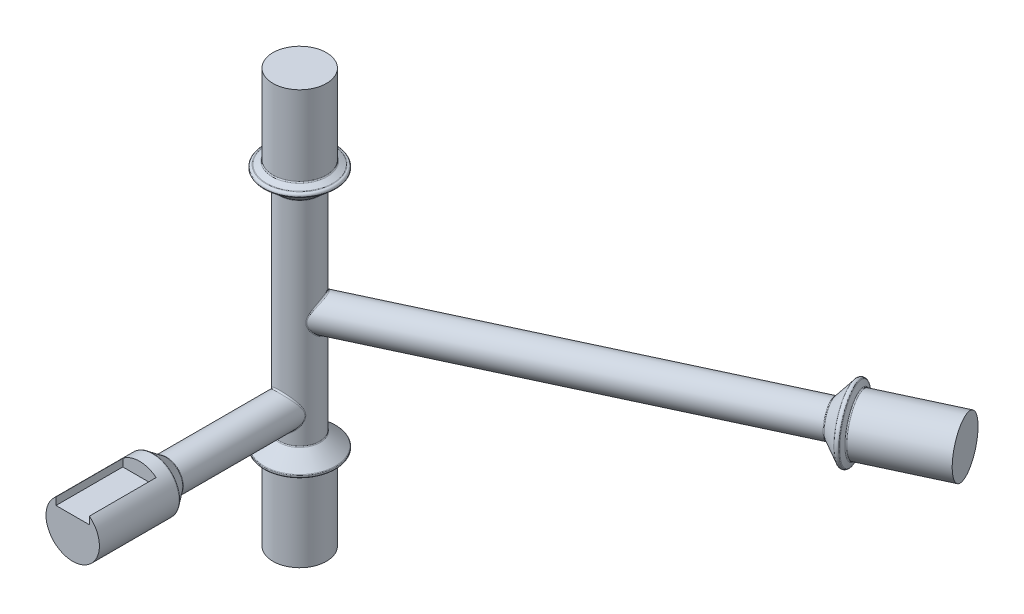
from build123d import *

# Parameters (mm, degrees)
SKETCH5_R           = 2.5
BOSS_EXTRUDE3_DEPTH = 20
SKETCH7_R           = 4
BOSS_EXTRUDE4_DEPTH = 14
SKETCH9_W           = 5
SKETCH9_H           = 10
CUT_EXTRUDE1_DEPTH  = 2
FILLET1_R           = 0.2


with BuildPart() as part:
    # Sketch3 → Revolve3 (revolve)
    with BuildSketch(Plane.XY, mode=Mode.PRIVATE) as revolve3_sk:
        with BuildLine():
            Line((4, 31), (0, 31))
            Line((0, 31), (0, 0))
            Line((0, 0), (3, 0))
            Line((3, 0), (3, 16))
            Line((3, 16), (5.365276993, 18))
            ThreePointArc((5.365276993, 18), (5.335582796, 18.361734067), (5, 18.5))
            Line((5, 18.5), (4, 19))
            Line((4, 19), (4, 31))
        make_face()
        with BuildLine():
            Line((3, 0), (0, 0))
            Line((0, 0), (0, -31))
            Line((0, -31), (4, -31))
            Line((4, -31), (4, -19))
            Line((4, -19), (5, -18.5))
            ThreePointArc((5, -18.5), (5.335582796, -18.361734067), (5.365276993, -18))
            Line((5.365276993, -18), (3, -16))
            Line((3, -16), (3, 0))
        make_face()
    revolve(revolve3_sk.sketch.rotate(Axis((0, 31, 0), (0, -1, 0)), 180), axis=Axis((0, 31, 0), (0, -1, 0)))

    # Sketch5 → Boss-Extrude3 (add)
    with BuildSketch(Plane.XY):
        with Locations(Location((0, -12, 0), (0, 0, 180))):
            Circle(SKETCH5_R)
    extrude(amount=BOSS_EXTRUDE3_DEPTH)

    # Sketch7 → Boss-Extrude4 (add)
    with BuildSketch(Plane.XY.offset(20)):
        with Locations((0, -12)):
            Circle(SKETCH7_R)
    extrude(amount=BOSS_EXTRUDE4_DEPTH)

    # Sketch8 → Cut-Revolve1 (revolve, cut)
    with BuildSketch(Plane(origin=(0, 0, 0), x_dir=(0, 0, -1), z_dir=(1, 0, 0)), mode=Mode.PRIVATE) as cut_revolve1_sk:
        Polygon((-20, -9.5), (-22, -8), (-20, -8), align=None)
    revolve(cut_revolve1_sk.sketch.rotate(Axis((0, -12, 34), (0, 0, -1)), 90), axis=Axis((0, -12, 34), (0, 0, -1)), mode=Mode.SUBTRACT)

    # Sketch9 → Cut-Extrude1 (cut)
    with BuildSketch(Plane(origin=(0, -8, 0), x_dir=(1, 0, 0), z_dir=(0, 1, 0))):
        with Locations((0, -29)):
            Rectangle(SKETCH9_W, SKETCH9_H)
    extrude(amount=-CUT_EXTRUDE1_DEPTH, mode=Mode.SUBTRACT)

    # Sketch10 → Revolve4 (revolve)
    with BuildSketch(Plane(origin=(0, 0, 0), x_dir=(1, 0, 0), z_dir=(0, 1, 0))):
        with BuildLine():
            Line((0, 0), (54.378467222, 25.357095704))
            Line((54.378467222, 25.357095704), (67.973084028, 31.696369631))
            Line((67.973084028, 31.696369631), (69.663557075, 28.071138482))
            Line((69.663557075, 28.071138482), (58.78786363, 22.999719342))
            Line((58.78786363, 22.999719342), (58.840562054, 22.001108869))
            ThreePointArc((58.840562054, 22.001108869), (58.544470874, 21.750496661), (58.165012877, 21.831045364))
            Line((58.165012877, 21.831045364), (55.435012877, 23.091326237))
            Line((55.435012877, 23.091326237), (1.056545654, -2.265769468))
            Line((1.056545654, -2.265769468), (0, 0))
        make_face()
    revolve(axis=Axis((0, 0, 0), (0.906307787036651, 0, -0.42261826174069705)))

    # Fillet1
    fillet1_edges = [part.edges().sort_by_distance(p)[0] for p in [
        (4, 19, 0),
        (5, 18.5, 0),
        (5.365276993, 18, 0),
        (3, 16, 0),
        (3, -16, 0),
        (5.365276993, -18, 0),
        (5, -18.5, 0),
        (2.5, -12, 1.658312395),
        (0, -14.5, 20),
        (-4, -12, 22),
        (0.446395783, 0, -2.966602569),
        (53.321921568, 0, -27.622865172),
        (54.111300583, 0, -30.524259431),
        (54.675811427, 0, -30.932445412),
        (55.406917536, 0, -30.250181638),
    ]]
    fillet(fillet1_edges, radius=FILLET1_R)


solid = part.part
